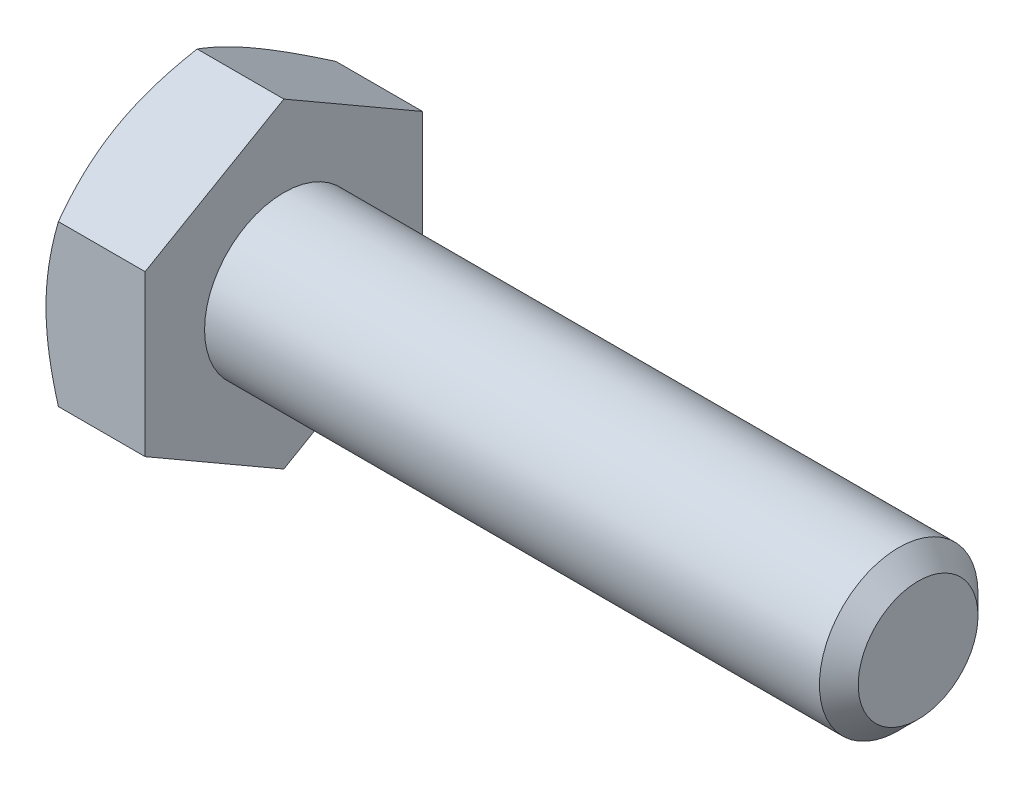
from build123d import *

# Parameters (mm, degrees)
SKETCH5_R           = 3.175
BOSS_EXTRUDE3_DEPTH = 25.4
CHAMFER1_SIZE       = 0.77724
BOSS_EXTRUDE4_DEPTH = 3.96875
SKETCH8_OUTSIDE_W   = 129.26
SKETCH8_OUTSIDE_H   = 130.98
SKETCH8_OUTSIDE_R   = 5.55625
CUT_EXTRUDE3_DEPTH  = 31.570540439
CUT_EXTRUDE3_DRAFT  = -60
CUT_EXTRUDE4_DEPTH  = 0.254
CIRPATTERN1_COUNT   = 3


with BuildPart() as part:
    # Sketch5 → Boss-Extrude3 (new body)
    with BuildSketch(Plane(origin=(14.684375, 0, 0), x_dir=(0, 0, -1), z_dir=(1, 0, 0))):
        Circle(SKETCH5_R)
    extrude(amount=-BOSS_EXTRUDE3_DEPTH)

    # Chamfer1
    chamfer1_edges = [part.edges().sort_by_distance(p)[0] for p in [
        (14.684375, 0, 3.175),
    ]]
    chamfer(chamfer1_edges, length=CHAMFER1_SIZE)

    # Sketch6 → Boss-Extrude4 (add)
    with BuildSketch(Plane.ZY.offset(10.715625)):
        Polygon((5.55625, 3.207902433), (0, 6.415804866), (-5.55625, 3.207902433), (-5.55625, -3.207902433), (0, -6.415804866), (5.55625, -3.207902433), align=None)
    extrude(amount=BOSS_EXTRUDE4_DEPTH)


with BuildPart() as cut_extrude3_tool:
    # Sketch8 outside → Cut-Extrude3 (with draft: the straight prism first)
    with BuildSketch(Plane.ZY.offset(14.684375)):
        Rectangle(SKETCH8_OUTSIDE_W, SKETCH8_OUTSIDE_H)
        Circle(SKETCH8_OUTSIDE_R, mode=Mode.SUBTRACT)
    extrude(amount=-CUT_EXTRUDE3_DEPTH)
    # Cut-Extrude3: the draft: its side faces are tilted about the plane it starts from
    cut_extrude3_sides = [cut_extrude3_tool.faces().sort_by_distance(p)[0] for p in [
        (1.100895219, -65.49, 0),
        (1.100895219, 0, 64.63),
        (1.100895219, 65.49, 0),
        (1.100895219, 0, -64.63),
        (1.100895219, 0, -5.55625),
    ]]
    draft(cut_extrude3_sides, Plane.ZY.offset(14.684375), CUT_EXTRUDE3_DRAFT)


with BuildPart() as part_1:
    add(part.part)

    # Cut-Extrude3: cut by cut_extrude3_tool
    add(cut_extrude3_tool.part, mode=Mode.SUBTRACT)

    # Sketch12 → Cut-Extrude4 (cut)
    with BuildSketch(Plane.ZY.offset(14.684375)):
        with BuildLine():
            Line((0.1666875, 4.2783125), (0.1666875, 2.3891875))
            ThreePointArc((0.1666875, 2.3891875), (0, 2.2225), (-0.1666875, 2.3891875))
            Line((-0.1666875, 2.3891875), (-0.1666875, 4.2783125))
            ThreePointArc((-0.1666875, 4.2783125), (0, 4.445), (0.1666875, 4.2783125))
        make_face()
    cut_extrude4 = extrude(amount=-CUT_EXTRUDE4_DEPTH, mode=Mode.SUBTRACT)

    # CirPattern1: Cut-Extrude4 ×3 about axis
    cirpattern1_axis = Axis((0, 0, 0), (1, 0, 0))
    for i in range(1, CIRPATTERN1_COUNT):
        add(cut_extrude4.rotate(cirpattern1_axis, i * 360 / CIRPATTERN1_COUNT), mode=Mode.SUBTRACT)


solid = part_1.part
